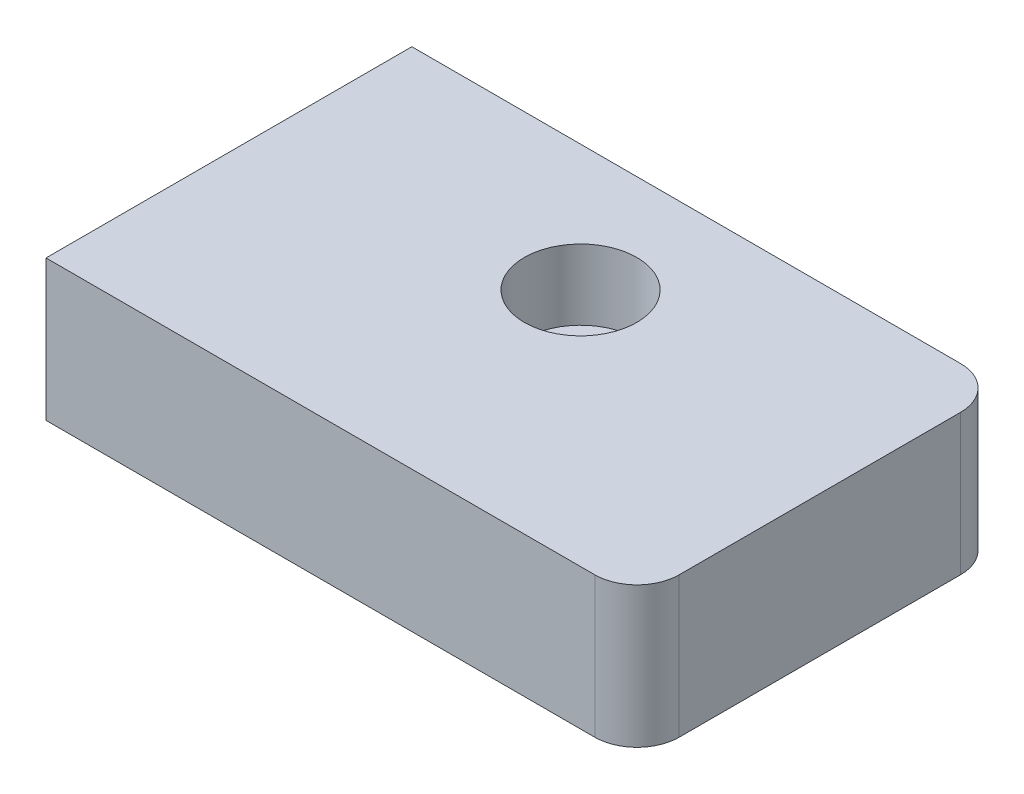
from build123d import *

# Parameters (mm, degrees)
SKETCH_1_W          = 42
SKETCH_1_H          = 26
EXTRUDE_1_DEPTH     = 10
SKETCH_2_R          = 4
CUT_EXTRUDE_1_DEPTH = 5
FILLET_1_R          = 3


with BuildPart() as part:
    # 草图1 → 凸台-拉伸1 (new body)
    with BuildSketch(Plane(origin=(0, 0, 0), x_dir=(1, 0, 0), z_dir=(0, 1, 0))):
        Rectangle(SKETCH_1_W, SKETCH_1_H)
    extrude(amount=EXTRUDE_1_DEPTH)

    # 草图2 → 切除-拉伸1 (cut)
    with BuildSketch(Plane(origin=(0, 10, 0), x_dir=(1, 0, 0), z_dir=(0, 1, 0))):
        with Locations(Location((-0.035567837, 4.026194604, 0), (0, 0, 270))):
            Circle(SKETCH_2_R)
    extrude(amount=-CUT_EXTRUDE_1_DEPTH, mode=Mode.SUBTRACT)

    # 圆角1
    fillet_1_edges = [part.edges().sort_by_distance(p)[0] for p in [
        (21, 5, 13),
        (21, 5, -13),
    ]]
    fillet(fillet_1_edges, radius=FILLET_1_R)


solid = part.part
